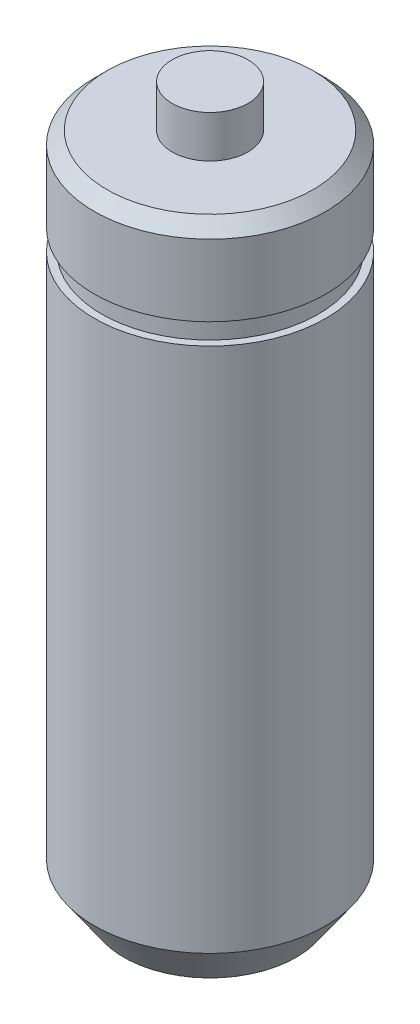
from build123d import *


with BuildPart() as part:
    # Sketch1 → Carcasa_motor_reductora (revolve)
    with BuildSketch(Plane.XY, mode=Mode.PRIVATE) as carcasa_motor_reductora_sk:
        Polygon((0, 2), (1.8, 2), (1.8, 0), (4.9, 0), (5.5, -0.6), (5.5, -4), (5.15, -4), (5.15, -5), (5.5, -5), (5.5, -30), (4.1, -32), (0, -32), align=None)
    revolve(carcasa_motor_reductora_sk.sketch.rotate(Axis((0, -36, 0), (0, 1, 0)), 90), axis=Axis((0, -36, 0), (0, 1, 0)))


solid = part.part
